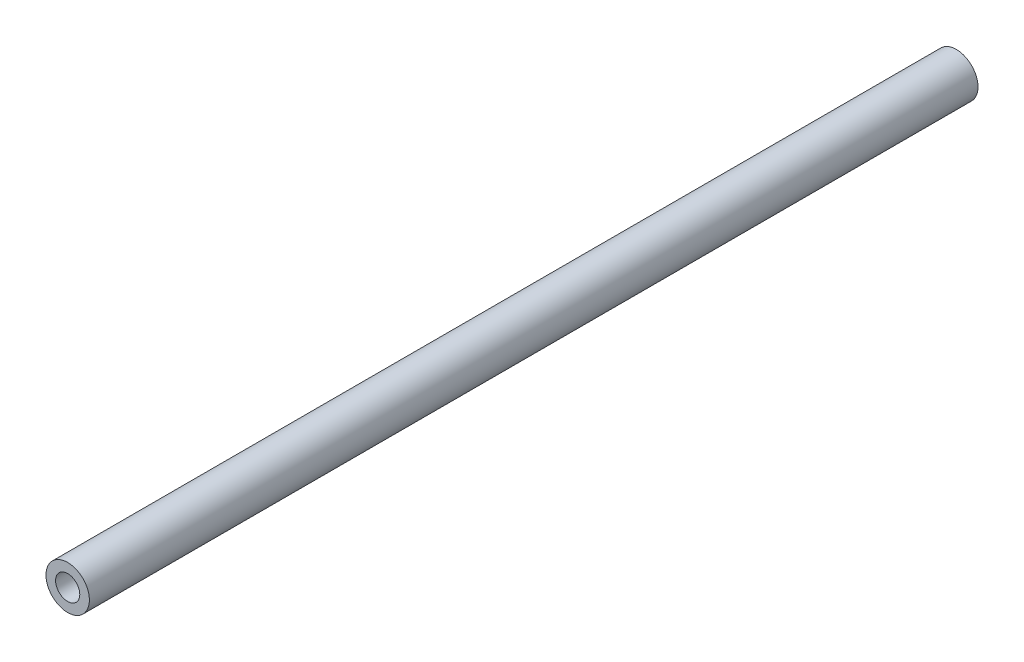
from build123d import *

# Parameters (mm, degrees)
SKETCH32_R          = 8.55
SKETCH32_R_2        = 4.765
BOSS_EXTRUDE1_DEPTH = 350


with BuildPart() as part:
    # Sketch32 → Boss-Extrude1 (new body)
    with BuildSketch(Plane.XY):
        Circle(SKETCH32_R)
        Circle(SKETCH32_R_2, mode=Mode.SUBTRACT)
    extrude(amount=BOSS_EXTRUDE1_DEPTH)


solid = part.part
